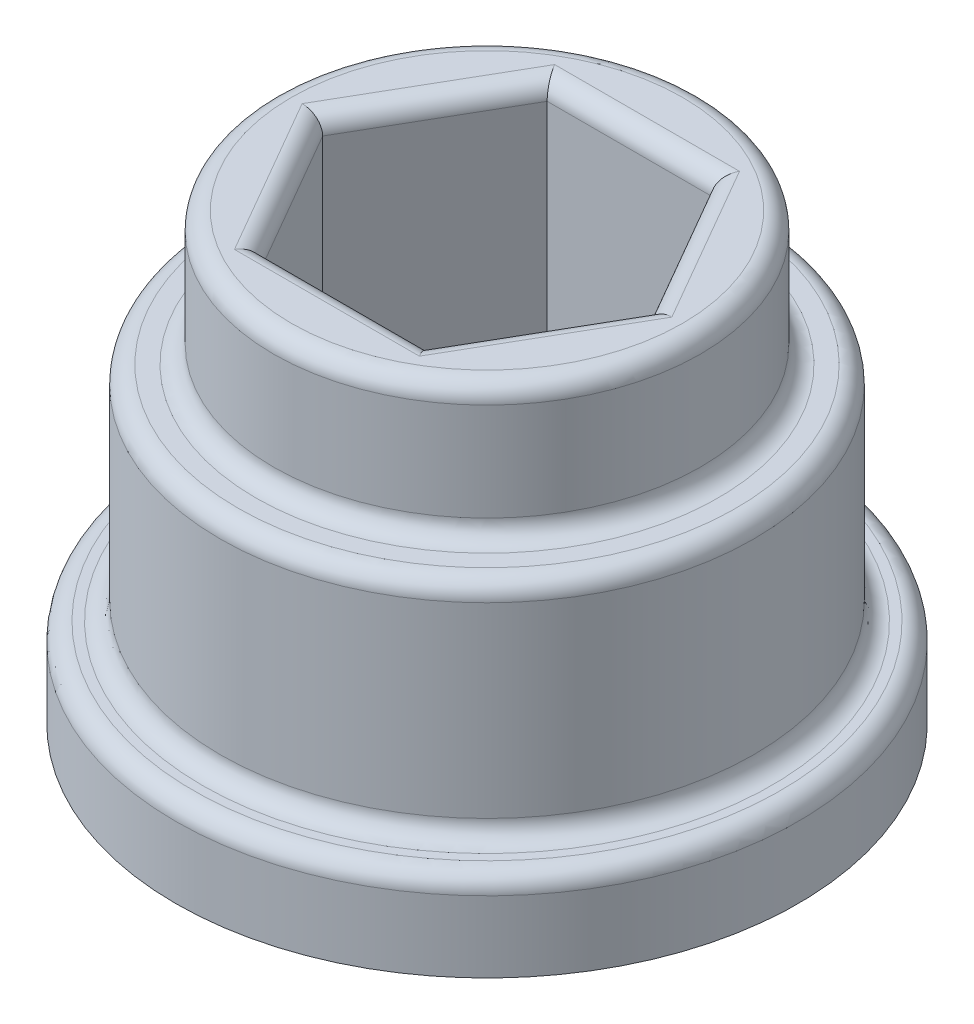
from build123d import *

# Parameters (mm, degrees)
SKETCH1_R           = 9.525
BOSS_EXTRUDE1_DEPTH = 7.9375
SKETCH2_R           = 7.62
BOSS_EXTRUDE2_DEPTH = 4.7625
SKETCH3_R           = 11.1125
BOSS_EXTRUDE3_DEPTH = 3.175
FILLET1_R           = 0.635
FILLET3_R           = 0.635
FILLET4_R           = 0.635


with BuildPart() as part:
    # Sketch1 → Boss-Extrude1 (new body)
    with BuildSketch(Plane(origin=(0, 0, 0), x_dir=(1, 0, 0), z_dir=(0, 1, 0))):
        with Locations(Location((0, 0, 0), (0, 0, 270))):
            Circle(SKETCH1_R)
        Polygon((5.865878735, 0), (2.932939367, 5.08), (-2.932939367, 5.08), (-5.865878735, 0), (-2.932939367, -5.08), (2.932939367, -5.08), align=None, mode=Mode.SUBTRACT)
    extrude(amount=BOSS_EXTRUDE1_DEPTH)

    # Sketch2 → Boss-Extrude2 (add)
    with BuildSketch(Plane(origin=(0, 7.9375, 0), x_dir=(1, 0, 0), z_dir=(0, 1, 0))):
        with Locations(Location((0, 0, 0), (0, 0, 90))):
            Circle(SKETCH2_R)
        Polygon((-2.932939367, 5.08), (-5.865878735, 0), (-2.932939367, -5.08), (2.932939367, -5.08), (5.865878735, 0), (2.932939367, 5.08), align=None, mode=Mode.SUBTRACT)
    extrude(amount=BOSS_EXTRUDE2_DEPTH)

    # Sketch3 → Boss-Extrude3 (add)
    with BuildSketch(Plane.XZ):
        with Locations(Location((0, 0, 0), (0, 0, 270))):
            Circle(SKETCH3_R)
        Polygon((-2.932939367, 5.08), (2.932939367, 5.08), (5.865878735, 0), (2.932939367, -5.08), (-2.932939367, -5.08), (-5.865878735, 0), align=None, mode=Mode.SUBTRACT)
    extrude(amount=BOSS_EXTRUDE3_DEPTH)

    # Fillet1
    fillet1_edges = [part.edges().sort_by_distance(p)[0] for p in [
        (0, 0, -9.525),
        (0, 0, 11.1125),
    ]]
    fillet(fillet1_edges, radius=FILLET1_R)

    # Fillet3
    fillet3_edges = [part.edges().sort_by_distance(p)[0] for p in [
        (0, 12.7, -5.08),
        (-4.399409051, 12.7, -2.54),
        (-4.399409051, 12.7, 2.54),
        (0, 12.7, 5.08),
        (4.399409051, 12.7, 2.54),
        (4.399409051, 12.7, -2.54),
    ]]
    fillet(fillet3_edges, radius=FILLET3_R)

    # Fillet4
    fillet4_edges = [part.edges().sort_by_distance(p)[0] for p in [
        (0, 12.7, 7.62),
        (0, 7.9375, 7.62),
        (0, 7.9375, -9.525),
    ]]
    fillet(fillet4_edges, radius=FILLET4_R)


solid = part.part
